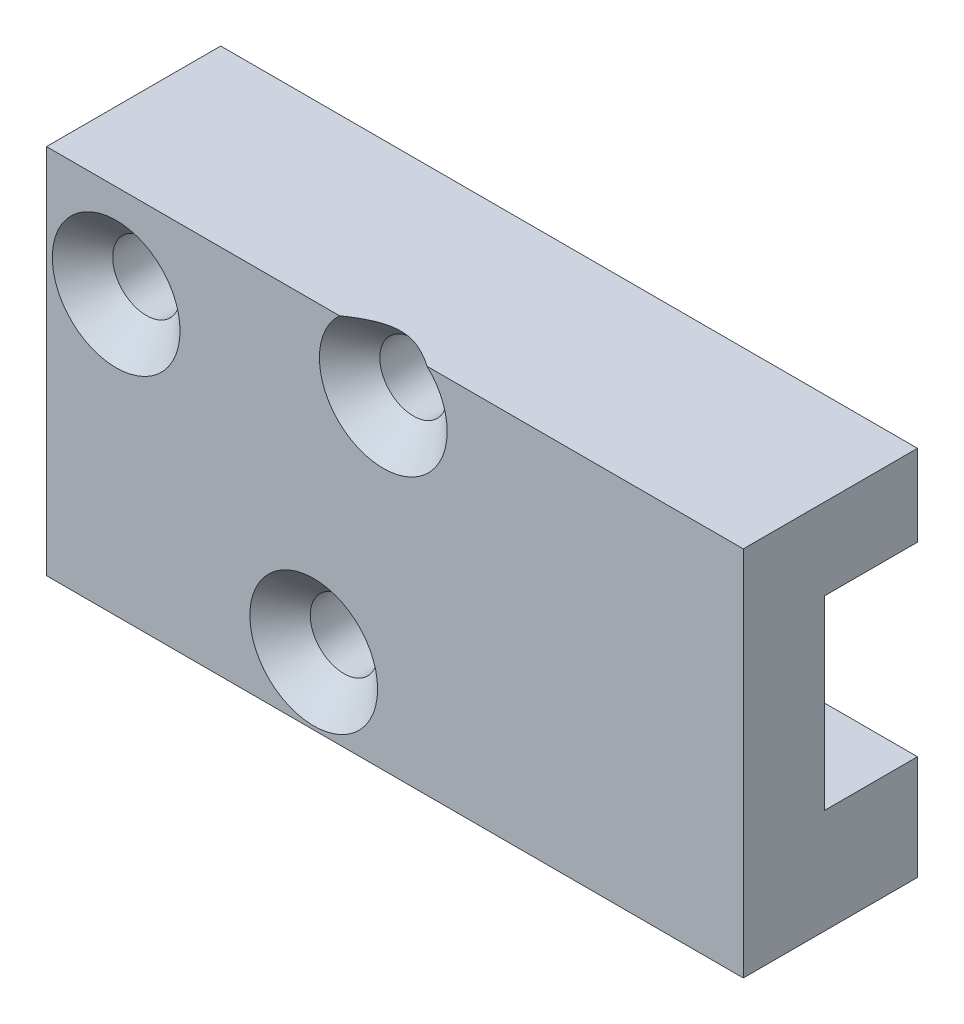
from build123d import *

# Parameters (mm, degrees)
BOSS_EXTRUDE1_DEPTH                                  = 4
BOSS_EXTRUDE1_2_DEPTH                                = 4
SKETCH2_W                                            = 30
SKETCH2_H                                            = 16
BOSS_EXTRUDE2_DEPTH                                  = 3.5
CSK_FOR_M2_5_COUNTERSUNK_FLAT_HEAD_SCREW_D           = 2.9
CSK_FOR_M2_5_COUNTERSUNK_FLAT_HEAD_SCREW_CSINK_D     = 5.5
CSK_FOR_M2_5_COUNTERSUNK_FLAT_HEAD_SCREW_CSINK_ANGLE = 90


with BuildPart() as part:
    # Sketch1 → Boss-Extrude1 (new body)
    with BuildSketch(Plane.XY.offset(0.579115056)):
        with BuildLine():
            Line((110.394950361, -18.30613426), (116.394950361, -18.30613426))
            Line((116.394950361, -18.30613426), (116.394950361, -19.30613426))
            Line((116.394950361, -19.30613426), (129.394950361, -19.30613426))
            Line((129.394950361, -19.30613426), (129.394950361, -23.80613426))
            Line((129.394950361, -23.80613426), (107.399951751, -23.80613426))
            Line((107.399951751, -23.80613426), (107.399951751, -21.00613426))
            ThreePointArc((107.399951751, -21.00613426), (108.376172059, -19.077900974), (110.394950361, -18.30613426))
        make_face()
    extrude(amount=BOSS_EXTRUDE1_DEPTH)



with BuildPart() as body_2:
    # Sketch1 → Boss-Extrude1 2 (new body)
    with BuildSketch(Plane.XY.offset(0.579115056)):
        with BuildLine():
            Line((101.399951751, -21.00613426), (101.399951751, -23.80613426))
            Line((101.399951751, -23.80613426), (99.394950361, -23.80613426))
            Line((99.394950361, -23.80613426), (99.394950361, -7.80613426))
            Line((99.394950361, -7.80613426), (129.394950361, -7.80613426))
            Line((129.394950361, -7.80613426), (129.394950361, -11.30613426))
            Line((129.394950361, -11.30613426), (116.394950361, -11.30613426))
            Line((116.394950361, -11.30613426), (116.394950361, -12.30613426))
            Line((116.394950361, -12.30613426), (110.394950361, -12.30613426))
            ThreePointArc((110.394950361, -12.30613426), (104.137954277, -14.836976664), (101.399951751, -21.00613426))
        make_face()
    extrude(amount=BOSS_EXTRUDE1_2_DEPTH)


with BuildPart() as part_1:
    add(part.part)

    add(body_2.part)  # Boss-Extrude2 merges body 2
    # Sketch2 → Boss-Extrude2 (add)
    with BuildSketch(Plane.XY.offset(4.579115056)):
        with Locations((114.394950361, -15.80613426)):
            Rectangle(SKETCH2_W, SKETCH2_H)
    extrude(amount=BOSS_EXTRUDE2_DEPTH)

    # CSK for M2.5 Countersunk Flat Head Screw1 (through all)
    with Locations(Plane.XY.offset(8.079115056)):
        with Locations((102.394950361, -11.80613426), (113.894950361, -9.80613426), (110.899951751, -20.90613426)):
            CounterSinkHole(CSK_FOR_M2_5_COUNTERSUNK_FLAT_HEAD_SCREW_D / 2, CSK_FOR_M2_5_COUNTERSUNK_FLAT_HEAD_SCREW_CSINK_D / 2, counter_sink_angle=CSK_FOR_M2_5_COUNTERSUNK_FLAT_HEAD_SCREW_CSINK_ANGLE)


solid = part_1.part
